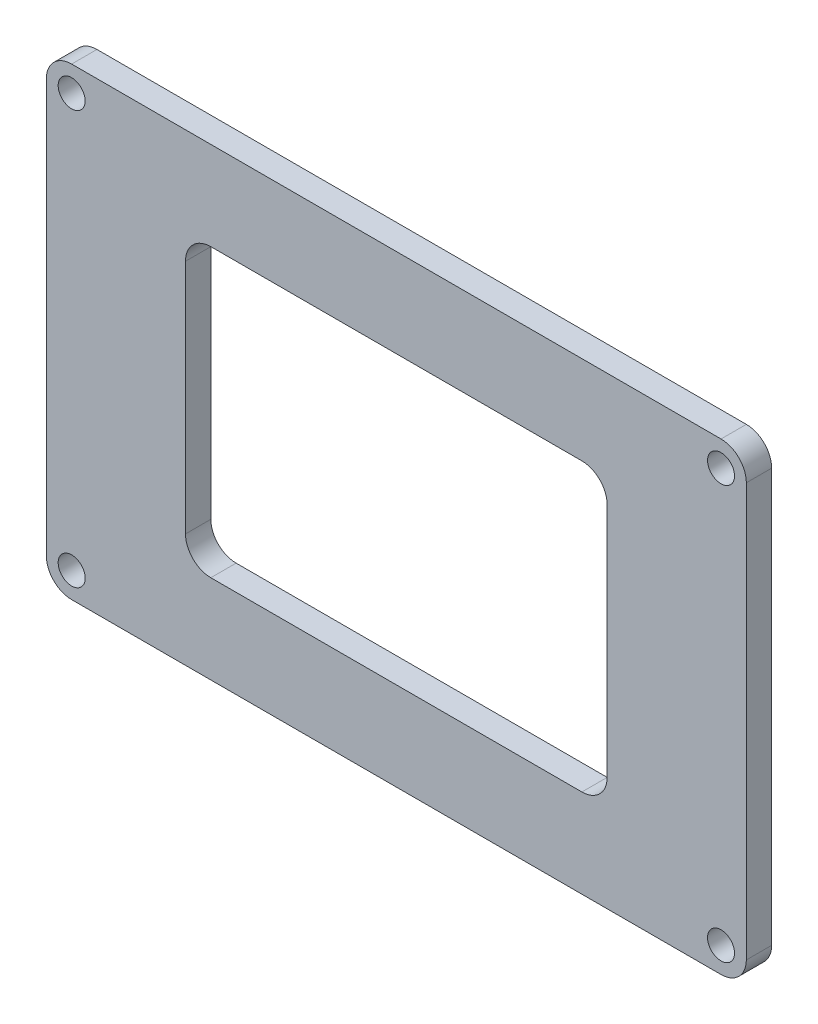
from build123d import *

# Parameters (mm, degrees)
SKETCH_1_R      = 1.6
EXTRUDE_1_DEPTH = 3


with BuildPart() as part:
    # 草图1 → 凸台-拉伸1 (new body)
    with BuildSketch(Plane.XY):
        with BuildLine():
            Line((0, -52), (77, -52))
            ThreePointArc((77, -52), (79.121320344, -51.121320344), (80, -49))
            Line((80, -49), (80, 0))
            ThreePointArc((80, 0), (79.121320344, 2.121320344), (77, 3))
            Line((77, 3), (0, 3))
            ThreePointArc((0, 3), (-2.121320344, 2.121320344), (-3, 0))
            Line((-3, 0), (-3, -49))
            ThreePointArc((-3, -49), (-2.121320344, -51.121320344), (0, -52))
        make_face()
        Circle(SKETCH_1_R, mode=Mode.SUBTRACT)
        with Locations((77, 0)):
            Circle(SKETCH_1_R, mode=Mode.SUBTRACT)
        with Locations((0, -49)):
            Circle(SKETCH_1_R, mode=Mode.SUBTRACT)
        with Locations((77, -49)):
            Circle(SKETCH_1_R, mode=Mode.SUBTRACT)
        with BuildLine():
            Line((16.5, -41.5), (60.5, -41.5))
            ThreePointArc((60.5, -41.5), (62.621320344, -40.621320344), (63.5, -38.5))
            Line((63.5, -38.5), (63.5, -10.5))
            ThreePointArc((63.5, -10.5), (62.621320344, -8.378679656), (60.5, -7.5))
            Line((60.5, -7.5), (16.5, -7.5))
            ThreePointArc((16.5, -7.5), (14.378679656, -8.378679656), (13.5, -10.5))
            Line((13.5, -10.5), (13.5, -38.5))
            ThreePointArc((13.5, -38.5), (14.378679656, -40.621320344), (16.5, -41.5))
        make_face(mode=Mode.SUBTRACT)
    extrude(amount=EXTRUDE_1_DEPTH)


solid = part.part
